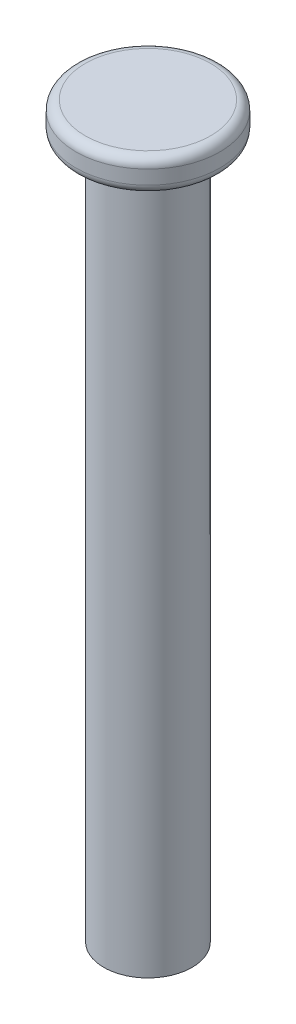
from build123d import *

# Parameters (mm, degrees)
SKETCH2_R           = 1.2065
BOSS_EXTRUDE1_DEPTH = 19.05
SKETCH3_R           = 1.9685
BOSS_EXTRUDE2_DEPTH = 0.889
FILLET1_R           = 0.254


with BuildPart() as part:
    # Sketch2 → Boss-Extrude1 (new body)
    with BuildSketch(Plane(origin=(0, 0, 0), x_dir=(1, 0, 0), z_dir=(0, 1, 0))):
        with Locations(Location((0, 0, 0), (0, 0, 90))):
            Circle(SKETCH2_R)
    extrude(amount=BOSS_EXTRUDE1_DEPTH)

    # Sketch3 → Boss-Extrude2 (add)
    with BuildSketch(Plane(origin=(0, 19.05, 0), x_dir=(1, 0, 0), z_dir=(0, 1, 0))):
        with Locations(Location((0, 0, 0), (0, 0, 270))):
            Circle(SKETCH3_R)
    extrude(amount=BOSS_EXTRUDE2_DEPTH)

    # Fillet1
    fillet1_edges = [part.edges().sort_by_distance(p)[0] for p in [
        (0, 19.05, -1.9685),
        (0, 19.939, -1.9685),
    ]]
    fillet(fillet1_edges, radius=FILLET1_R)


solid = part.part
